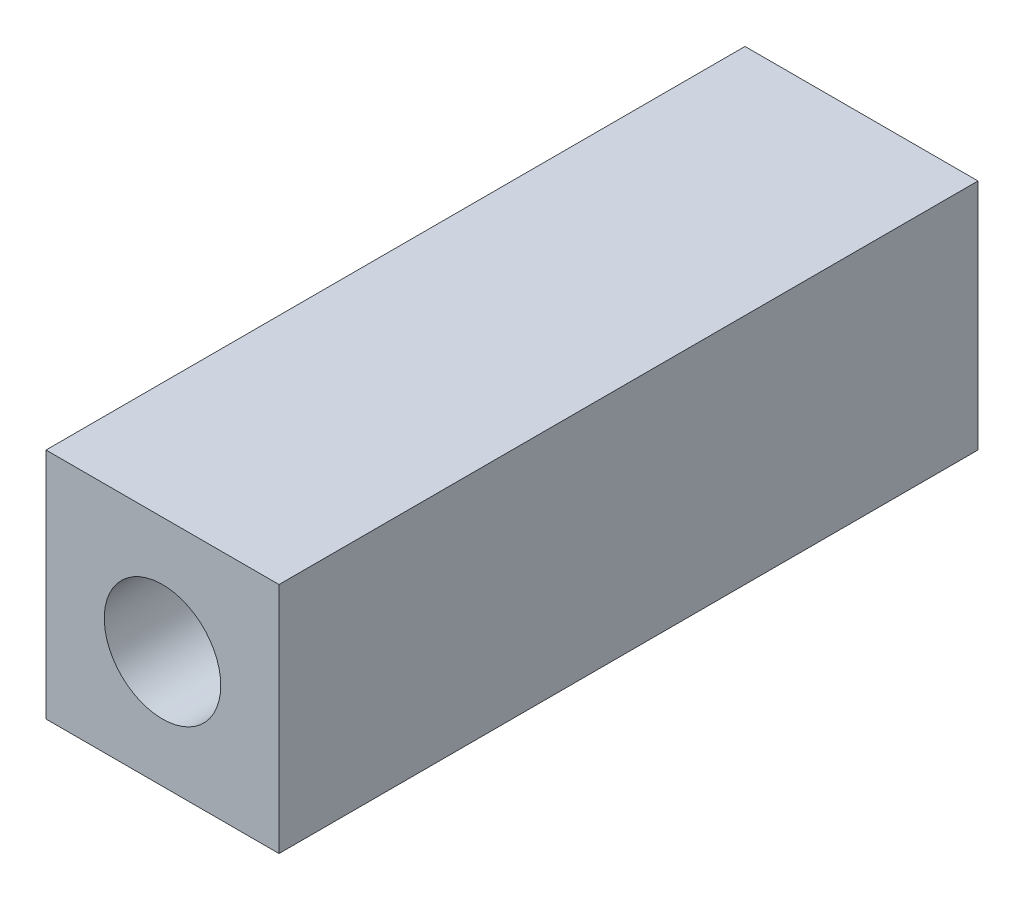
from build123d import *

# Parameters (mm, degrees)
ESQUISSE1_W = 10
ESQUISSE1_H = 10
ESQUISSE1_R = 2.5
BASE_DEPTH  = 30


with BuildPart() as part:
    # Esquisse1 → BASE (new body)
    with BuildSketch(Plane.XY):
        Rectangle(ESQUISSE1_W, ESQUISSE1_H)
        Circle(ESQUISSE1_R, mode=Mode.SUBTRACT)
    extrude(amount=BASE_DEPTH)


solid = part.part
